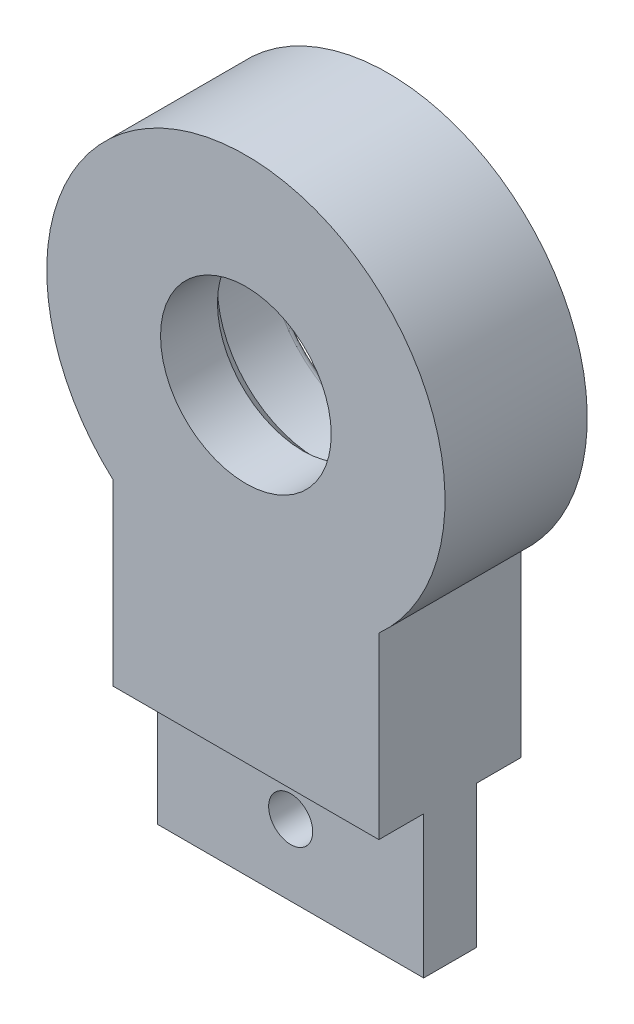
from build123d import *

# Parameters (mm, degrees)
SKETCH1_R           = 8
BOSS_EXTRUDE1_DEPTH = 10
SKETCH2_W           = 3.7
SKETCH2_H           = 20
BOSS_EXTRUDE2_DEPTH = 18.7
SKETCH3_R           = 1.55
CUT_EXTRUDE1_DEPTH  = 18.7
BOSS_EXTRUDE3_START = -5
SKETCH4_R           = 8
SKETCH4_R_2         = 6
BOSS_EXTRUDE3_DEPTH = 5
CHAMFER1_SIZE       = 1
FILLET1_R           = 0.5


with BuildPart() as part:
    # Sketch1 → Boss-Extrude1 (new body)
    with BuildSketch(Plane.XY):
        with BuildLine():
            Line((-9.35, -4.920052783), (-9.35, -17.5))
            Line((-9.35, -17.5), (9.35, -17.5))
            Line((9.35, -17.5), (9.35, -4.920052783))
            ThreePointArc((9.35, -4.920052783), (0, 19.5), (-9.35, -4.920052783))
        make_face()
        with Locations((0, 5.5)):
            Circle(SKETCH1_R, mode=Mode.SUBTRACT)
    extrude(amount=BOSS_EXTRUDE1_DEPTH)

    # Sketch2 → Boss-Extrude2 (add)
    with BuildSketch(Plane(origin=(9.35, 0, 0), x_dir=(0, 0, -1), z_dir=(1, 0, 0))):
        with Locations((-5, -17.5)):
            Rectangle(SKETCH2_W, SKETCH2_H)
    extrude(amount=-BOSS_EXTRUDE2_DEPTH)

    # Sketch3 → Cut-Extrude1 (cut)
    with BuildSketch(Plane.XY.offset(6.85)):
        with Locations((0, -22.5)):
            Circle(SKETCH3_R)
    extrude(amount=-CUT_EXTRUDE1_DEPTH, mode=Mode.SUBTRACT)

    # Sketch4 → Boss-Extrude3 (add)
    with BuildSketch(Plane.XY.offset(10).offset(BOSS_EXTRUDE3_START)):
        with Locations((0, 5.5)):
            Circle(SKETCH4_R)
        with Locations((0, 5.5)):
            Circle(SKETCH4_R_2, mode=Mode.SUBTRACT)
    extrude(amount=BOSS_EXTRUDE3_DEPTH)

    # Chamfer1
    chamfer1_edges = [part.edges().sort_by_distance(p)[0] for p in [
        (-6, 5.5, 5),
    ]]
    chamfer(chamfer1_edges, length=CHAMFER1_SIZE)

    # Fillet1
    fillet1_edges = [part.edges().sort_by_distance(p)[0] for p in [
        (-8, 5.5, 0),
    ]]
    fillet(fillet1_edges, radius=FILLET1_R)


solid = part.part
